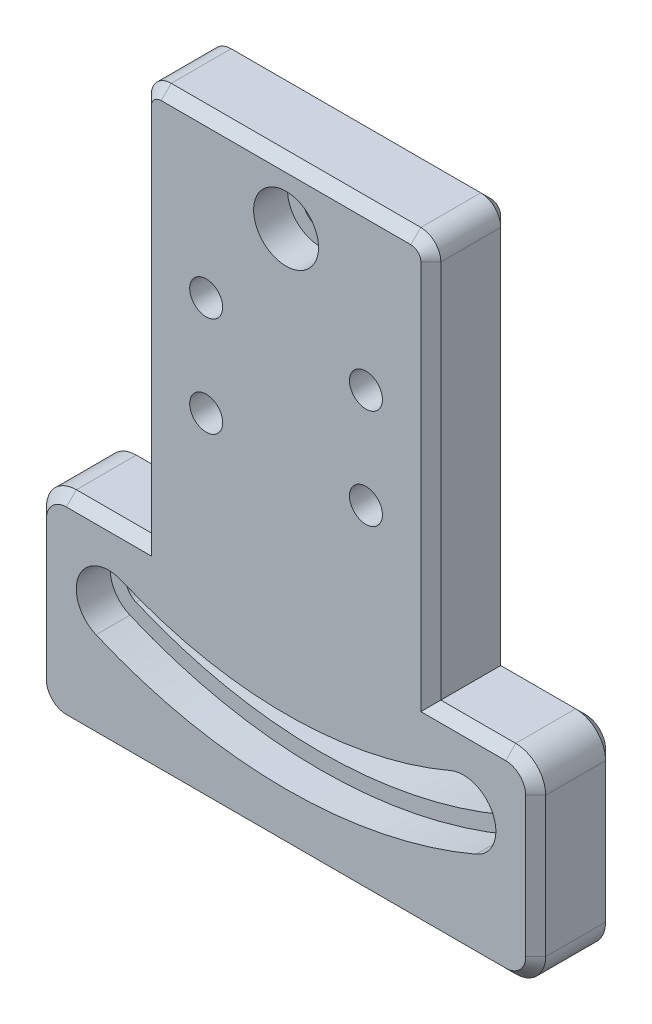
from build123d import *

# Parameters (mm, degrees)
SKETCH1_W                                           = 50
SKETCH1_H                                           = 73
BOSS_EXTRUDE1_DEPTH                                 = 8
CBORE_FOR_M3_HEX_SOCKET_HEAD_CAP_SCREW1_D           = 3.4
CBORE_FOR_M3_HEX_SOCKET_HEAD_CAP_SCREW1_CBORE_D     = 6.5
CBORE_FOR_M3_HEX_SOCKET_HEAD_CAP_SCREW1_CBORE_DEPTH = 3.4
CUT_EXTRUDE1_DEPTH                                  = 3.4
CUT_EXTRUDE2_DEPTH                                  = 16.4
SKETCH9_W                                           = 50
SKETCH9_H                                           = 13
CUT_EXTRUDE3_DEPTH                                  = 10
CUT_EXTRUDE6_DEPTH                                  = 49
FILLET1_R                                           = 3
FILLET2_R                                           = 2
M4_TAPPED_HOLE1_D                                   = 3.3
M4_TAPPED_HOLE1_DEPTH                               = 6
M4_TAPPED_HOLE1_TIP                                 = 0.991420021
CUT_EXTRUDE9_DEPTH                                  = 1
CHAMFER2_SIZE                                       = 1
CHAMFER3_SIZE                                       = 1


with BuildPart() as part:
    # Sketch1 → Boss-Extrude1 (new body)
    with BuildSketch(Plane.XY):
        Rectangle(SKETCH1_W, SKETCH1_H)
    extrude(amount=BOSS_EXTRUDE1_DEPTH)

    # CBORE for M3 Hex Socket Head Cap Screw1 (through all)
    with Locations(Plane.XY.offset(8)):
        with Locations((0, 17.64)):
            CounterBoreHole(CBORE_FOR_M3_HEX_SOCKET_HEAD_CAP_SCREW1_D / 2, CBORE_FOR_M3_HEX_SOCKET_HEAD_CAP_SCREW1_CBORE_D / 2, CBORE_FOR_M3_HEX_SOCKET_HEAD_CAP_SCREW1_CBORE_DEPTH)

    # Sketch5 → Cut-Extrude1 (cut)
    with BuildSketch(Plane.XY.offset(8)):
        with BuildLine():
            ThreePointArc((-19.034141209, -27.101138862), (0, -30.981682799), (19.034141209, -27.101138862))
            ThreePointArc((19.034141209, -27.101138862), (20.752463932, -22.838232925), (16.489557996, -21.119910203))
            ThreePointArc((16.489557996, -21.119910203), (0, -24.481682799), (-16.489557996, -21.119910203))
            ThreePointArc((-16.489557996, -21.119910203), (-20.752463932, -22.838232925), (-19.034141209, -27.101138862))
        make_face()
    extrude(amount=-CUT_EXTRUDE1_DEPTH, mode=Mode.SUBTRACT)

    # Sketch6 → Cut-Extrude2 (cut)
    with BuildSketch(Plane.XY.offset(4.6)):
        with BuildLine():
            ThreePointArc((-18.427355981, -25.674845874), (0, -29.431682799), (18.427355981, -25.674845874))
            ThreePointArc((18.427355981, -25.674845874), (19.326170944, -23.445018153), (17.096343223, -22.546203191))
            ThreePointArc((17.096343223, -22.546203191), (0, -26.031682799), (-17.096343223, -22.546203191))
            ThreePointArc((-17.096343223, -22.546203191), (-19.326170944, -23.445018153), (-18.427355981, -25.674845874))
        make_face()
    extrude(amount=-CUT_EXTRUDE2_DEPTH, mode=Mode.SUBTRACT)

    # Sketch9 → Cut-Extrude3 (cut)
    with BuildSketch(Plane.XY.offset(8)):
        with Locations((0, 30)):
            Rectangle(SKETCH9_W, SKETCH9_H)
    extrude(amount=-CUT_EXTRUDE3_DEPTH, mode=Mode.SUBTRACT)

    # Sketch10 → Cut-Extrude6 (cut)
    with BuildSketch(Plane.XY.offset(8)):
        Polygon((-14.5, 23.5), (-14.5, -16.5), (-25, -16.5), (-32.867212943, -16.5), (-35.349336633, 40.207518582), (-6.106494824, 43.004037027), (18.040764003, 43.004037027), (35.555684922, 29.266712136), (37.966370543, 22.69314443), (41.94143417, 11.853759291), (39.953902356, 3.910005632), (32.212385861, -8.825532839), (28.601359922, -14.76601747), (25, -16.5), (14.5, -16.5), (14.5, 23.5), align=None)
    extrude(amount=-CUT_EXTRUDE6_DEPTH, mode=Mode.SUBTRACT)

    # Fillet1
    fillet1_edges = [part.edges().sort_by_distance(p)[0] for p in [
        (25, -36.5, 4),
        (-25, -36.5, 4),
        (25, -16.5, 4),
        (-25, -16.5, 4),
    ]]
    fillet(fillet1_edges, radius=FILLET1_R)

    # Fillet2
    fillet2_edges = [part.edges().sort_by_distance(p)[0] for p in [
        (-14.5, 23.5, 4),
        (14.5, 23.5, 4),
    ]]
    fillet(fillet2_edges, radius=FILLET2_R)

    # M4 Tapped Hole1
    with Locations(Plane.XY.offset(8)):
        with Locations((-8, -2.36), (8, -2.36), (-8, 7.64), (8, 7.64)):
            Hole(M4_TAPPED_HOLE1_D / 2, depth=M4_TAPPED_HOLE1_DEPTH)
            with Locations((0, 0, -(M4_TAPPED_HOLE1_DEPTH + M4_TAPPED_HOLE1_TIP / 2))):  # 118° drill point
                Cone(0, M4_TAPPED_HOLE1_D / 2, M4_TAPPED_HOLE1_TIP, mode=Mode.SUBTRACT)

    # Sketch14 → Cut-Extrude9 (cut)
    with BuildSketch(Plane(origin=(0, 0, 0), x_dir=(-1, 0, 0), z_dir=(0, 0, -1))):
        with BuildLine():
            Line((-12, -33.5), (12, -33.5))
            ThreePointArc((12, -33.5), (14.121320344, -34.378679656), (15, -36.5))
            Line((15, -36.5), (-15, -36.5))
            ThreePointArc((-15, -36.5), (-14.121320344, -34.378679656), (-12, -33.5))
        make_face()
    extrude(amount=-CUT_EXTRUDE9_DEPTH, mode=Mode.SUBTRACT)

    # Chamfer2
    chamfer2_edges = [part.edges().sort_by_distance(p)[0] for p in [
        (-18.25, -16.5, 8),
        (18.25, -16.5, 8),
        (-24.121320344, -17.378679656, 8),
        (24.121320344, -17.378679656, 8),
        (-25, -26.5, 8),
        (25, -26.5, 8),
        (-24.121320344, -35.621320344, 8),
        (24.121320344, -35.621320344, 8),
        (0, -36.5, 8),
        (-14.5, 2.5, 0),
        (-13.914213562, 22.914213562, 0),
        (0, 23.5, 0),
        (13.914213562, 22.914213562, 0),
        (14.5, 2.5, 0),
        (18.25, -16.5, 0),
        (24.121320344, -17.378679656, 0),
        (25, -26.5, 0),
        (24.121320344, -35.621320344, 0),
        (18.5, -36.5, 0),
        (-18.25, -16.5, 0),
        (-24.121320344, -17.378679656, 0),
        (-25, -26.5, 0),
        (-24.121320344, -35.621320344, 0),
        (-18.5, -36.5, 0),
    ]]
    chamfer(chamfer2_edges, length=CHAMFER2_SIZE)

    # Chamfer3
    chamfer3_edges = [part.edges().sort_by_distance(p)[0] for p in [
        (14.5, 2, 8),
        (13.914213562, 22.914213562, 8),
        (0, 23.5, 8),
        (-13.914213562, 22.914213562, 8),
        (-14.5, 2, 8),
    ]]
    chamfer(chamfer3_edges, length=CHAMFER3_SIZE)


solid = part.part
